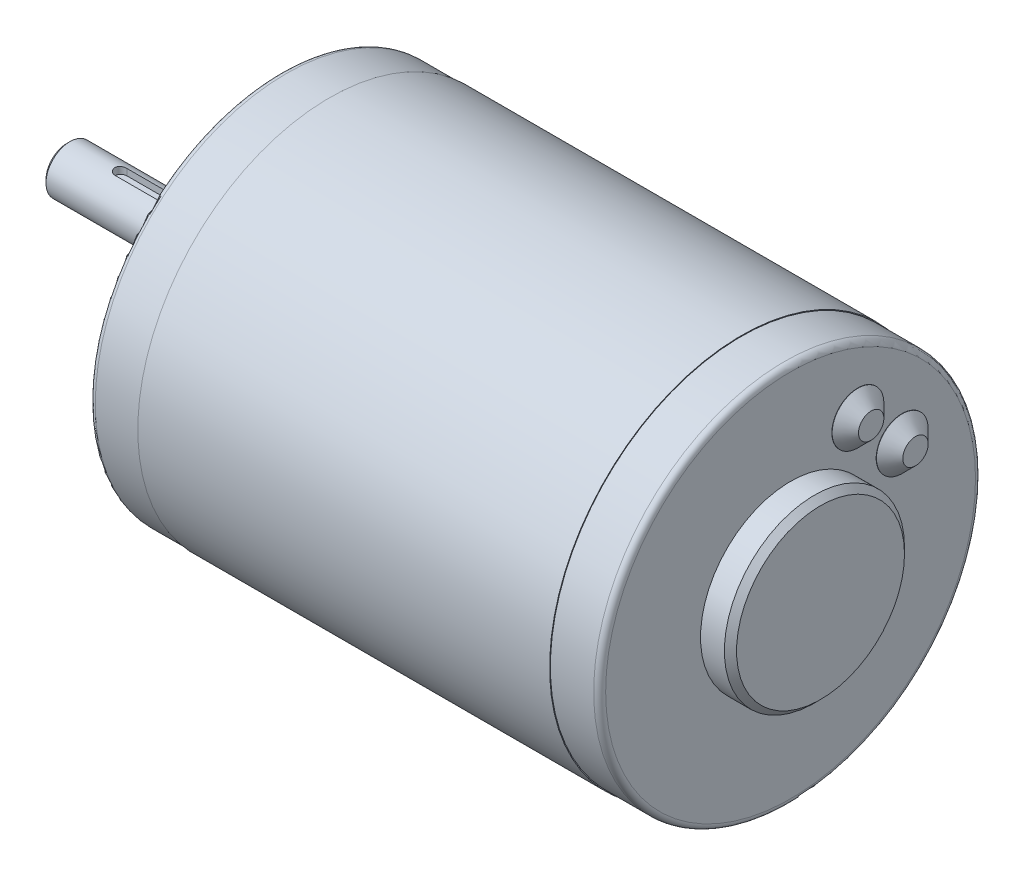
from build123d import *

# Parameters (mm, degrees)
SKETCH1_R                  = 32.004
BOSS_EXTRUDE1_DEPTH        = 68.7568
SKETCH2_R                  = 31.877
BOSS_EXTRUDE2_DEPTH        = 8.2296
SKETCH3_R                  = 15.0368
BOSS_EXTRUDE3_DEPTH        = 5
BOSS_EXTRUDE4_START        = 8.2296
SKETCH4_R                  = 31.877
BOSS_EXTRUDE4_DEPTH        = 8.2296
SKETCH5_R                  = 9.525
BOSS_EXTRUDE5_DEPTH        = 4
SKETCH6_R                  = 4
BOSS_EXTRUDE6_DEPTH        = 31.6
CUT_EXTRUDE1_REACH         = 103.855
CUT_EXTRUDE1_END_RADIUS    = 4
F_10_32_TAPPED_HOLE1_D     = 4.0386
F_10_32_TAPPED_HOLE1_DEPTH = 12.03
F_10_32_TAPPED_HOLE1_TIP   = 1.213317848
CHAMFER1_SIZE              = 1.016
CHAMFER2_SIZE              = 0.5
FILLET1_R                  = 1


with BuildPart() as part:
    # Sketch1 → Boss-Extrude1 (new body)
    with BuildSketch(Plane(origin=(8.2296, 0, 0), x_dir=(0, -1, 0), z_dir=(-1, 0, 0))):
        with Locations(Location((0, 0, 0), (0, 0, 270))):
            Circle(SKETCH1_R)
    extrude(amount=-BOSS_EXTRUDE1_DEPTH)

    # Sketch2 → Boss-Extrude2 (add)
    with BuildSketch(Plane(origin=(76.9864, 0, 0), x_dir=(0, 0, -1), z_dir=(1, 0, 0))):
        Circle(SKETCH2_R)
    extrude(amount=BOSS_EXTRUDE2_DEPTH)

    # Sketch3 → Boss-Extrude3 (add)
    with BuildSketch(Plane(origin=(85.216, 0, 0), x_dir=(0, 0, -1), z_dir=(1, 0, 0))):
        Circle(SKETCH3_R)
    extrude(amount=BOSS_EXTRUDE3_DEPTH)

    # Sketch4 → Boss-Extrude4 (add)
    with BuildSketch(Plane.ZY.offset(-8.2296).offset(BOSS_EXTRUDE4_START)):
        with Locations(Location((0, 0, 0), (0, 0, 180))):
            Circle(SKETCH4_R)
    extrude(amount=-BOSS_EXTRUDE4_DEPTH)

    # Sketch5 → Boss-Extrude5 (add)
    with BuildSketch(Plane.ZY):
        Circle(SKETCH5_R)
    extrude(amount=BOSS_EXTRUDE5_DEPTH)

    # Sketch6 → Boss-Extrude6 (add)
    with BuildSketch(Plane.ZY.offset(4)):
        Circle(SKETCH6_R)
    extrude(amount=BOSS_EXTRUDE6_DEPTH)

    # Cut-Extrude1: up to this cylinder (the profile starts inside it)
    cut_extrude1_end = Plane(origin=(-16.85, 0, 0), z_dir=(1, 0, 0)) * Cylinder(CUT_EXTRUDE1_END_RADIUS, 216.71, mode=Mode.PRIVATE)
    # Sketch7 → Cut-Extrude1 (cut, up to the surface)
    with BuildSketch(Plane.XZ.offset(-2.8), mode=Mode.PRIVATE) as cut_extrude1_sk1:
        with BuildLine():
            Line((-7.1, 1), (-26.6, 1))
            ThreePointArc((-26.6, 1), (-27.6, 0), (-26.6, -1))
            Line((-26.6, -1), (-7.1, -1))
            ThreePointArc((-7.1, -1), (-6.1, 0), (-7.1, 1))
        make_face()
    cut_extrude1_tool1 = extrude(cut_extrude1_sk1.sketch, amount=-CUT_EXTRUDE1_REACH, mode=Mode.PRIVATE) & cut_extrude1_end
    add(cut_extrude1_tool1.solids().sort_by_distance((-16.85, 2.8, 0))[0], mode=Mode.SUBTRACT)

    # Sketch8 → Revolve1 (revolve)
    with BuildSketch(Plane.XY.offset(-18.607090683), mode=Mode.PRIVATE) as revolve1_sk:
        Polygon((85.216, 15.525359639), (85.216, 11.207359639), (87.4639, 11.207359639), (87.4639, 13.325359639), (85.2639, 15.525359639), align=None)
    revolve(revolve1_sk.sketch.rotate(Axis((85.216, 11.207359639, -18.607090683), (1, 0, 0)), 270), axis=Axis((85.216, 11.207359639, -18.607090683), (1, 0, 0)))

    # Sketch9 → Revolve2 (revolve)
    with BuildSketch(Plane.XY.offset(-11.207359639), mode=Mode.PRIVATE) as revolve2_sk:
        Polygon((85.216, 22.925090683), (85.216, 18.607090683), (87.4639, 18.607090683), (87.4639, 20.725090683), (85.2639, 22.925090683), align=None)
    revolve(revolve2_sk.sketch.rotate(Axis((85.216, 18.607090683, -11.207359639), (1, 0, 0)), 270), axis=Axis((85.216, 18.607090683, -11.207359639), (1, 0, 0)))

    # #10-32 Tapped Hole1
    with Locations(Plane.ZY):
        with Locations((0, 25.4), (0, -25.4)):
            Hole(F_10_32_TAPPED_HOLE1_D / 2, depth=F_10_32_TAPPED_HOLE1_DEPTH)
            with Locations((0, 0, -(F_10_32_TAPPED_HOLE1_DEPTH + F_10_32_TAPPED_HOLE1_TIP / 2))):  # 118° drill point
                Cone(0, F_10_32_TAPPED_HOLE1_D / 2, F_10_32_TAPPED_HOLE1_TIP, mode=Mode.SUBTRACT)

    # Chamfer1
    chamfer1_edges = [part.edges().sort_by_distance(p)[0] for p in [
        (90.216, 0, 15.0368),
        (-4, 0, -9.525),
    ]]
    chamfer(chamfer1_edges, length=CHAMFER1_SIZE)

    # Chamfer2
    chamfer2_edges = [part.edges().sort_by_distance(p)[0] for p in [
        (-35.6, 0, -4),
    ]]
    chamfer(chamfer2_edges, length=CHAMFER2_SIZE)

    # Fillet1
    fillet1_edges = [part.edges().sort_by_distance(p)[0] for p in [
        (0, 0, 31.877),
        (85.216, 0, 31.877),
    ]]
    fillet(fillet1_edges, radius=FILLET1_R)


solid = part.part
